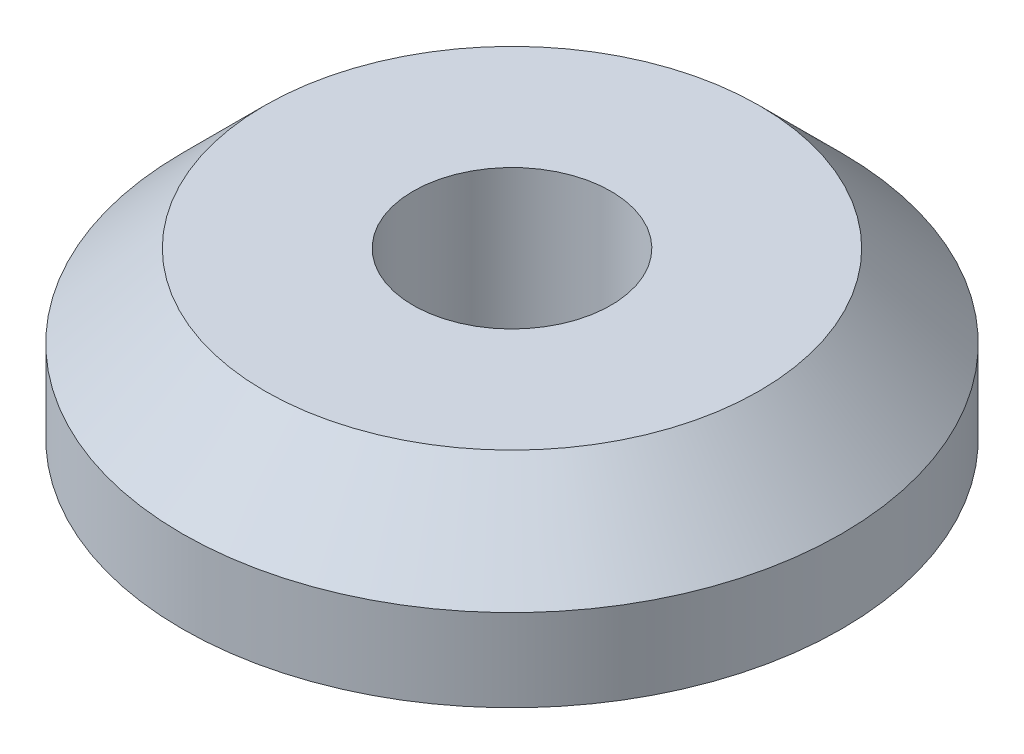
from build123d import *


with BuildPart() as part:
    # Sketch1 → Revolve1 (revolve)
    with BuildSketch(Plane.XY):
        Polygon((-1.905, 0), (-1.905, -4.7498), (-3.5687, -4.7498), (-3.5687, -3.175), (-6.35, -3.175), (-6.35, -1.5875), (-4.7625, 0), align=None)
    revolve(axis=Axis((0, 0, 0), (0, -1, 0)))


solid = part.part
